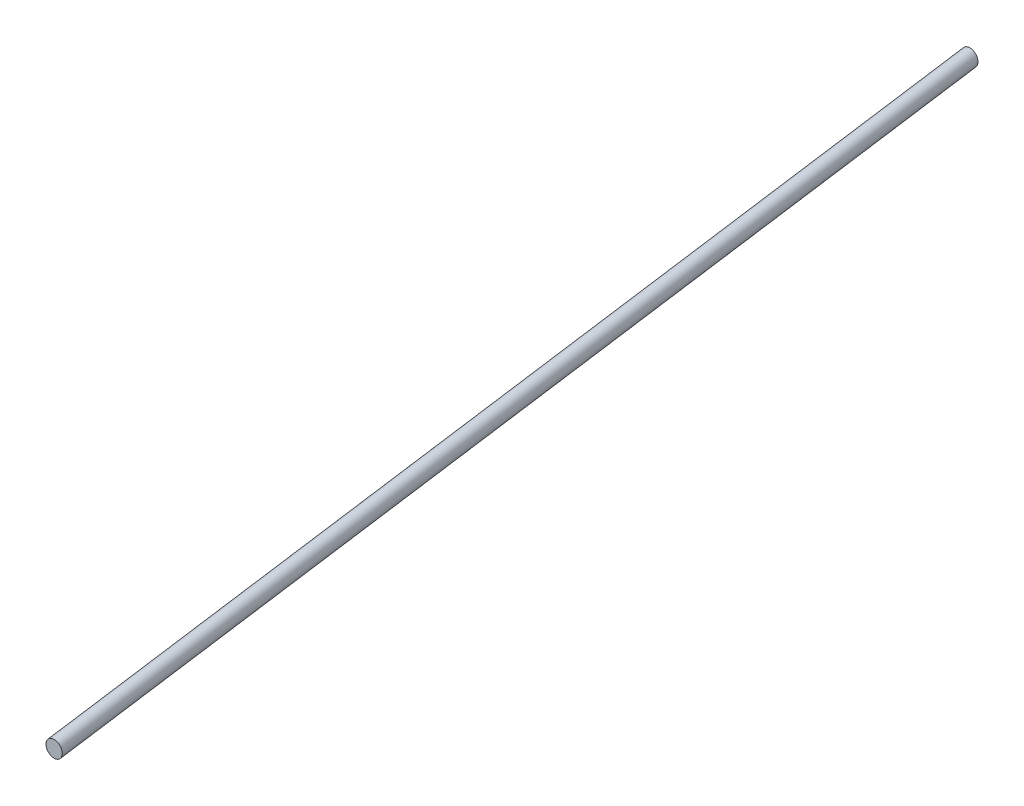
from build123d import *

# Parameters (mm, degrees)
SKETCH_6_R = 4


with BuildPart() as part:
    # 扫描2: sweep along a path in 草图4
    with BuildLine(Plane(origin=(0, 0, 0), x_dir=(1, 0, 0), z_dir=(0, 1, 0))) as sweep_2_path:
        Line((-55, 0), (14.3, -519))
    # 草图6 → 扫描2 (sweep)
    with BuildSketch(Plane.XY):
        with Locations((19.1, 2.1)):
            Circle(SKETCH_6_R)
    sweep(path=sweep_2_path.line)


solid = part.part
